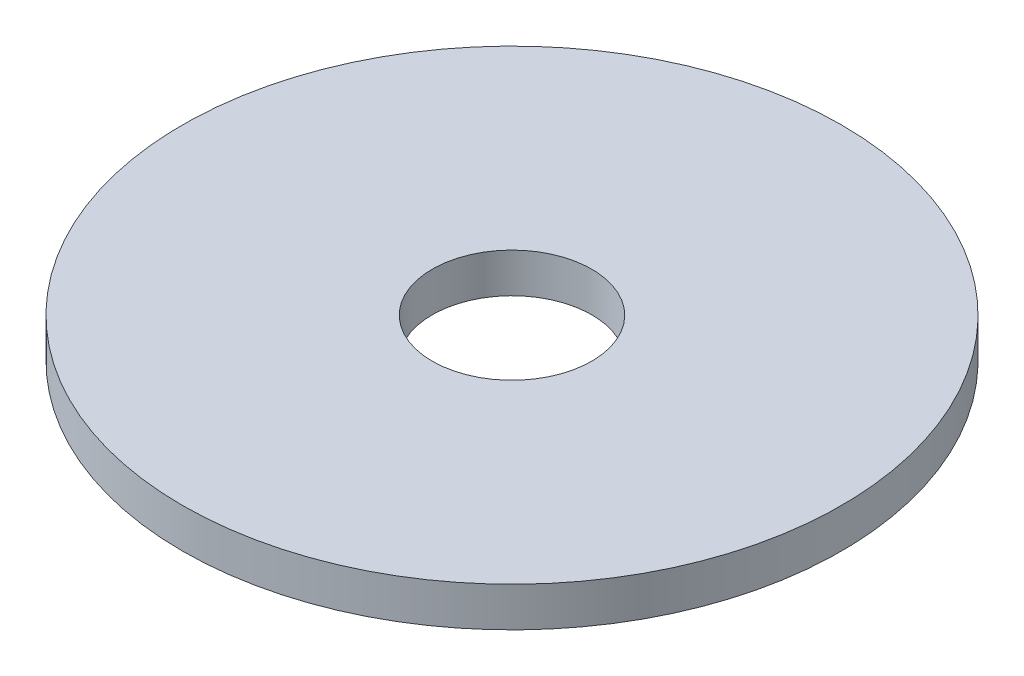
from build123d import *

# Parameters (mm, degrees)
SKETCH1_R           = 25
SKETCH1_R_2         = 6.05
BOSS_EXTRUDE1_DEPTH = 3


with BuildPart() as part:
    # Sketch1 → Boss-Extrude1 (new body)
    with BuildSketch(Plane(origin=(0, 0, 0), x_dir=(1, 0, 0), z_dir=(0, 1, 0))):
        with Locations(Location((0, 0, 0), (0, 0, 270))):
            Circle(SKETCH1_R)
        with Locations(Location((0, 0, 0), (0, 0, 270))):
            Circle(SKETCH1_R_2, mode=Mode.SUBTRACT)
    extrude(amount=BOSS_EXTRUDE1_DEPTH)


solid = part.part
